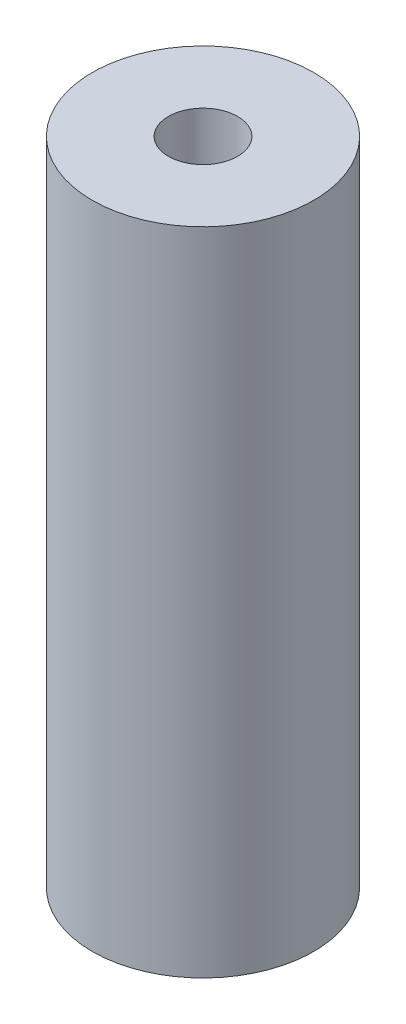
from build123d import *

# Parameters (mm, degrees)
SKETCH_1_R         = 4
EXTRUDE_3_DEPTH    = 23.5
HOLE_WIZARD_M3_1_D = 2.5


with BuildPart() as part:
    # 草图1 → 凸台-拉伸3 (new body)
    with BuildSketch(Plane(origin=(0, 0, 0), x_dir=(1, 0, 0), z_dir=(0, 1, 0))):
        with Locations(Location((0, 0, 0), (0, 0, 270))):
            Circle(SKETCH_1_R)
    extrude(amount=EXTRUDE_3_DEPTH)

    # M3 螺纹孔1 (through all)
    with Locations(Plane(origin=(0, 0, 0), x_dir=(-1, 0, 0), z_dir=(0, -1, 0))):
        with Locations((0, 0)):
            Hole(HOLE_WIZARD_M3_1_D / 2)


solid = part.part
